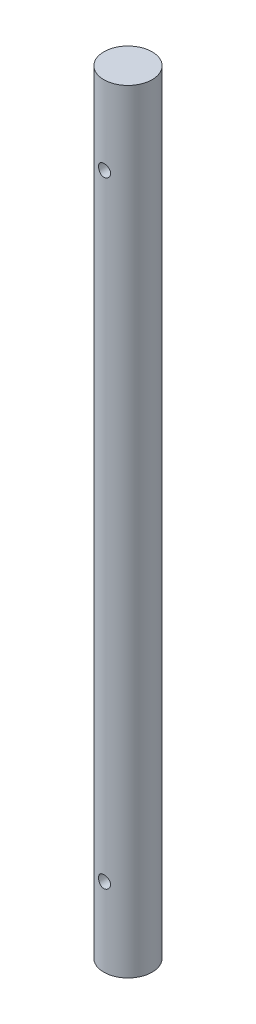
from build123d import *

# Parameters (mm, degrees)
SKETCH1_R               = 6.35
BOSS_EXTRUDE1_DEPTH     = 203.2
CUT_EXTRUDE1_DEPTH      = 204.398340701
CUT_EXTRUDE1_DEPTH_BACK = 204.398340701
SKETCH2_R               = 1.5875


with BuildPart() as part:
    # Sketch1 → Boss-Extrude1 (new body)
    with BuildSketch(Plane(origin=(0, 0, 0), x_dir=(1, 0, 0), z_dir=(0, 1, 0))):
        with Locations(Location((0, 0, 0), (0, 0, 270))):
            Circle(SKETCH1_R)
    extrude(amount=BOSS_EXTRUDE1_DEPTH)

    # Sketch2 → Cut-Extrude1 (cut, two sides: drawn at the far end of the back side and taken through both)
    with BuildSketch(Plane.XY.offset(-CUT_EXTRUDE1_DEPTH_BACK)):
        with Locations(Location((0, 182.5625, 0), (0, 0, 90.000000004))):
            Circle(SKETCH2_R)
        with Locations(Location((0, 20.6375, 0), (0, 0, 90.000000004))):
            Circle(SKETCH2_R)
    extrude(amount=CUT_EXTRUDE1_DEPTH + CUT_EXTRUDE1_DEPTH_BACK, mode=Mode.SUBTRACT)


solid = part.part
